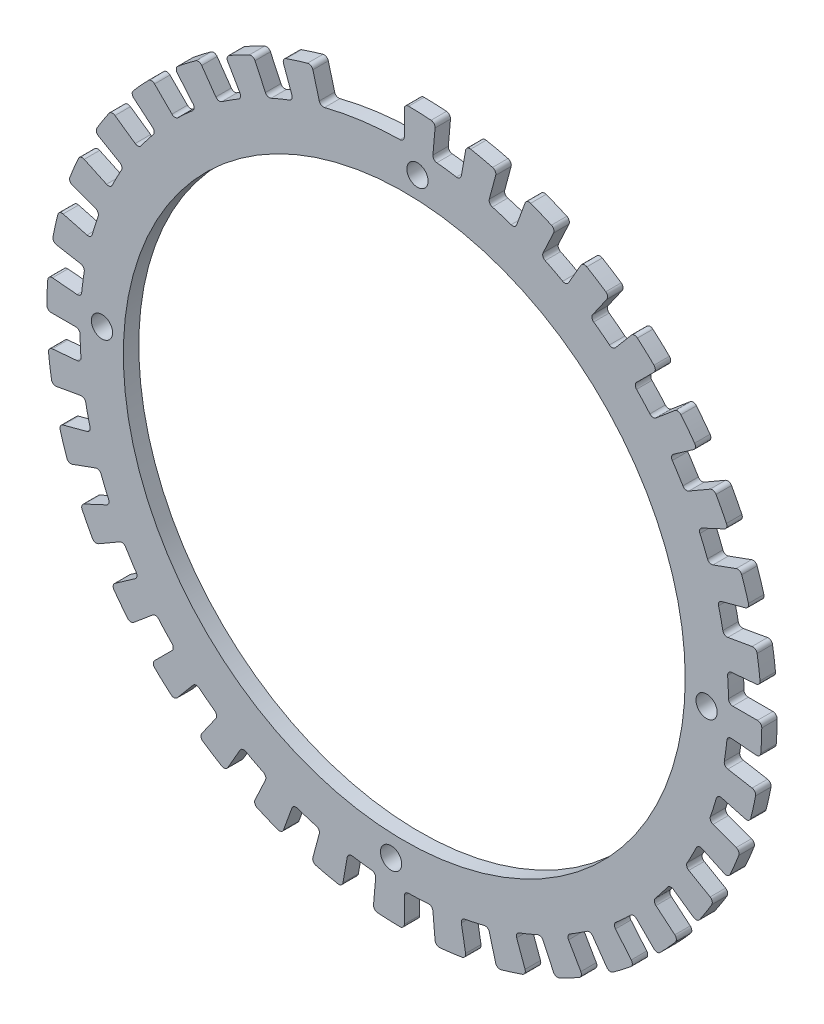
from build123d import *

# Parameters (mm, degrees)
SKETCH1_R           = 64.990473148
SKETCH1_R_2         = 2.4585
BOSS_EXTRUDE1_DEPTH = 3.571875


with BuildPart() as part:
    # Sketch1 → Boss-Extrude1 (new body)
    with BuildSketch(Plane.XY):
        with BuildLine():
            Line((7.120090774, 81.383009943), (6.623263031, 75.704242859))
            ThreePointArc((6.623263031, 75.704242859), (6.849200908, 74.979353293), (7.519201706, 74.622125443))
            ThreePointArc((7.519201706, 74.622125443), (9.789464417, 74.358364603), (12.05063613, 74.025550784))
            ThreePointArc((12.05063613, 74.025550784), (12.790264576, 74.197197423), (13.196119031, 74.83890995))
            Line((13.196119031, 74.83890995), (14.185993357, 80.45276622))
            ThreePointArc((14.185993357, 80.45276622), (14.60224868, 81.101765071), (15.35649023, 81.261726586))
            ThreePointArc((15.35649023, 81.261726586), (17.899556073, 80.739679789), (20.424982959, 80.138068801))
            ThreePointArc((20.424982959, 80.138068801), (21.040955292, 79.674338181), (21.143931966, 78.910228368))
            Line((21.143931966, 78.910228368), (19.668544597, 73.404007748))
            ThreePointArc((19.668544597, 73.404007748), (19.765174218, 72.650897183), (20.362964234, 72.182752009))
            ThreePointArc((20.362964234, 72.182752009), (22.552934963, 71.528771306), (24.721961884, 70.808365329))
            ThreePointArc((24.721961884, 70.808365329), (25.480159838, 70.848969138), (25.991280663, 71.410456724))
            Line((25.991280663, 71.410456724), (27.940952485, 76.76713603))
            ThreePointArc((27.940952485, 76.76713603), (28.463581422, 77.333993152), (29.234141374, 77.360551822))
            ThreePointArc((29.234141374, 77.360551822), (31.647919857, 76.404837339), (34.030511182, 75.373830397))
            ThreePointArc((34.030511182, 75.373830397), (34.556599534, 74.810182414), (34.525325484, 74.039799434))
            Line((34.525325484, 74.039799434), (32.116207389, 68.873429005))
            ThreePointArc((32.116207389, 68.873429005), (32.080592711, 68.114980325), (32.588008397, 67.550142181))
            ThreePointArc((32.588008397, 67.550142181), (34.631145993, 66.525812488), (36.642123336, 65.439703525))
            ThreePointArc((36.642123336, 65.439703525), (37.395853336, 65.348030778), (37.996710384, 65.812232905))
            Line((37.996710384, 65.812232905), (40.84693991, 70.748975258))
            ThreePointArc((40.84693991, 70.748975258), (41.460062645, 71.216466984), (42.223527925, 71.108815836))
            ThreePointArc((42.223527925, 71.108815836), (44.43467761, 69.748472569), (46.602039543, 68.319396297))
            ThreePointArc((46.602039543, 68.319396297), (47.022258986, 67.67295711), (46.857684459, 66.91970866))
            Line((46.857684459, 66.91970866), (43.58803547, 62.250165975))
            ThreePointArc((43.58803547, 62.250165975), (43.421258628, 61.509424257), (43.822882416, 60.865055465))
            ThreePointArc((43.822882416, 60.865055465), (45.657107176, 59.501500522), (47.448932412, 58.082689443))
            ThreePointArc((47.448932412, 58.082689443), (48.175292755, 57.86152557), (48.847629287, 58.214337693))
            Line((48.847629287, 58.214337693), (52.511813735, 62.581142673))
            ThreePointArc((52.511813735, 62.581142673), (53.196800845, 62.935064503), (53.929973946, 62.696474464))
            ThreePointArc((53.929973946, 62.696474464), (55.87131017, 60.972835754), (57.757588515, 59.189111912))
            ThreePointArc((57.757588515, 59.189111912), (58.059170893, 58.479523249), (57.766296402, 57.766296402))
            Line((57.766296402, 57.766296402), (53.735463151, 53.735463151))
            ThreePointArc((53.735463151, 53.735463151), (53.442591574, 53.034935459), (53.726220327, 52.330614838))
            ThreePointArc((53.726220327, 52.330614838), (55.295800261, 50.669265571), (56.814029687, 48.960862234))
            ThreePointArc((56.814029687, 48.960862234), (57.490950281, 48.616927187), (58.214337693, 48.847629287))
            Line((58.214337693, 48.847629287), (62.581142673, 52.511813735))
            ThreePointArc((62.581142673, 52.511813735), (63.31718117, 52.741411935), (63.997784998, 52.379132441))
            ThreePointArc((63.997784998, 52.379132441), (65.610321242, 50.344570179), (67.158202386, 48.260396313))
            ThreePointArc((67.158202386, 48.260396313), (67.331984272, 47.509218665), (66.91970866, 46.857684459))
            Line((66.91970866, 46.857684459), (62.250165975, 43.58803547))
            ThreePointArc((62.250165975, 43.58803547), (61.840098418, 42.949006984), (61.997114221, 42.20613496))
            ThreePointArc((61.997114221, 42.20613496), (63.254358436, 40.297470626), (64.45286142, 38.351384001))
            ThreePointArc((64.45286142, 38.351384001), (65.059774375, 37.895128073), (65.812232905, 37.996710384))
            Line((65.812232905, 37.996710384), (70.748975258, 40.84693991))
            ThreePointArc((70.748975258, 40.84693991), (71.513700985, 40.945238253), (72.121055738, 40.470276985))
            ThreePointArc((72.121055738, 40.470276985), (73.355795904, 38.186610315), (74.518248261, 35.865312993))
            ThreePointArc((74.518248261, 35.865312993), (74.55894938, 35.095370514), (74.039799434, 34.525325484))
            Line((74.039799434, 34.525325484), (68.873429005, 32.116207389))
            ThreePointArc((68.873429005, 32.116207389), (68.358625165, 31.558094665), (68.384257172, 30.799243028))
            ThreePointArc((68.384257172, 30.799243028), (69.290964938, 28.701257427), (70.133325573, 26.576618372))
            ThreePointArc((70.133325573, 26.576618372), (70.651790146, 26.021904668), (71.410456724, 25.991280663))
            Line((71.410456724, 25.991280663), (76.76713603, 27.940952485))
            ThreePointArc((76.76713603, 27.940952485), (77.537313183, 27.904964226), (78.052964694, 27.331752641))
            ThreePointArc((78.052964694, 27.331752641), (78.872391827, 24.868369619), (79.614094871, 22.380480286))
            ThreePointArc((79.614094871, 22.380480286), (79.52047854, 21.615167288), (78.910228368, 21.143931966))
            Line((78.910228368, 21.143931966), (73.404007748, 19.668544597))
            ThreePointArc((73.404007748, 19.668544597), (72.800109677, 19.208305609), (72.693579072, 18.456531682))
            ThreePointArc((72.693579072, 18.456531682), (73.222200534, 16.232971045), (73.682824118, 13.994335642))
            ThreePointArc((73.682824118, 13.994335642), (74.097087025, 13.358018857), (74.83890995, 13.196119031))
            Line((74.83890995, 13.196119031), (80.45276622, 14.185993357))
            ThreePointArc((80.45276622, 14.185993357), (81.204993357, 14.016811982), (81.613273815, 13.362766823))
            ThreePointArc((81.613273815, 13.362766823), (81.992490036, 10.794516097), (82.290907495, 8.215628011))
            ThreePointArc((82.290907495, 8.215628011), (82.065818199, 7.478198142), (81.383009943, 7.120090774))
            Line((81.383009943, 7.120090774), (75.704242859, 6.623263031))
            ThreePointArc((75.704242859, 6.623263031), (75.029599695, 6.274881906), (74.794143357, 5.55302796))
            ThreePointArc((74.794143357, 5.55302796), (74.928616619, 3.271454052), (74.993507337, 0.986842105))
            ThreePointArc((74.993507337, 0.986842105), (75.290981409, 0.288256403), (75.993420768, 0))
            Line((75.993420768, 0), (81.69387982, 0))
            ThreePointArc((81.69387982, 0), (82.405300898, -0.297234001), (82.693804909, -1.012239902))
            ThreePointArc((82.693804909, -1.012239902), (82.621287925, -3.607323335), (82.467352536, -6.198851964))
            ThreePointArc((82.467352536, -6.198851964), (82.1176295, -6.88599227), (81.383009943, -7.120090774))
            Line((81.383009943, -7.120090774), (75.704242859, -6.623263031))
            ThreePointArc((75.704242859, -6.623263031), (74.979353293, -6.849200908), (74.622125443, -7.519201706))
            ThreePointArc((74.622125443, -7.519201706), (74.358364603, -9.789464417), (74.025550784, -12.05063613))
            ThreePointArc((74.025550784, -12.05063613), (74.197197423, -12.790264576), (74.83890995, -13.196119031))
            Line((74.83890995, -13.196119031), (80.45276622, -14.185993357))
            ThreePointArc((80.45276622, -14.185993357), (81.101765071, -14.60224868), (81.261726586, -15.35649023))
            ThreePointArc((81.261726586, -15.35649023), (80.739679789, -17.899556073), (80.138068801, -20.424982959))
            ThreePointArc((80.138068801, -20.424982959), (79.674338181, -21.040955292), (78.910228368, -21.143931966))
            Line((78.910228368, -21.143931966), (73.404007748, -19.668544597))
            ThreePointArc((73.404007748, -19.668544597), (72.650897183, -19.765174218), (72.182752009, -20.362964234))
            ThreePointArc((72.182752009, -20.362964234), (71.528771306, -22.552934963), (70.808365329, -24.721961884))
            ThreePointArc((70.808365329, -24.721961884), (70.848969138, -25.480159838), (71.410456724, -25.991280663))
            Line((71.410456724, -25.991280663), (76.76713603, -27.940952485))
            ThreePointArc((76.76713603, -27.940952485), (77.333993152, -28.463581422), (77.360551822, -29.234141374))
            ThreePointArc((77.360551822, -29.234141374), (76.404837339, -31.647919857), (75.373830397, -34.030511182))
            ThreePointArc((75.373830397, -34.030511182), (74.810182414, -34.556599534), (74.039799434, -34.525325484))
            Line((74.039799434, -34.525325484), (68.873429005, -32.116207389))
            ThreePointArc((68.873429005, -32.116207389), (68.114980325, -32.080592711), (67.550142181, -32.588008397))
            ThreePointArc((67.550142181, -32.588008397), (66.525812488, -34.631145993), (65.439703525, -36.642123336))
            ThreePointArc((65.439703525, -36.642123336), (65.348030778, -37.395853336), (65.812232905, -37.996710384))
            Line((65.812232905, -37.996710384), (70.748975258, -40.84693991))
            ThreePointArc((70.748975258, -40.84693991), (71.216466984, -41.460062645), (71.108815836, -42.223527925))
            ThreePointArc((71.108815836, -42.223527925), (69.748472569, -44.43467761), (68.319396297, -46.602039543))
            ThreePointArc((68.319396297, -46.602039543), (67.67295711, -47.022258986), (66.91970866, -46.857684459))
            Line((66.91970866, -46.857684459), (62.250165974, -43.58803547))
            ThreePointArc((62.250165974, -43.58803547), (61.509424257, -43.421258628), (60.865055465, -43.822882416))
            ThreePointArc((60.865055465, -43.822882416), (59.501500522, -45.657107176), (58.082689443, -47.448932412))
            ThreePointArc((58.082689443, -47.448932412), (57.86152557, -48.175292755), (58.214337693, -48.847629287))
            Line((58.214337693, -48.847629287), (62.581142673, -52.511813735))
            ThreePointArc((62.581142673, -52.511813735), (62.935064503, -53.196800845), (62.696474464, -53.929973946))
            ThreePointArc((62.696474464, -53.929973946), (60.972835754, -55.87131017), (59.189111912, -57.757588515))
            ThreePointArc((59.189111912, -57.757588515), (58.479523249, -58.059170893), (57.766296402, -57.766296402))
            Line((57.766296402, -57.766296402), (53.735463151, -53.735463151))
            ThreePointArc((53.735463151, -53.735463151), (53.034935459, -53.442591574), (52.330614838, -53.726220327))
            ThreePointArc((52.330614838, -53.726220327), (50.669265571, -55.295800261), (48.960862234, -56.814029687))
            ThreePointArc((48.960862234, -56.814029687), (48.616927187, -57.490950281), (48.847629287, -58.214337693))
            Line((48.847629287, -58.214337693), (52.511813735, -62.581142673))
            ThreePointArc((52.511813735, -62.581142673), (52.741411935, -63.31718117), (52.379132441, -63.997784998))
            ThreePointArc((52.379132441, -63.997784998), (50.344570179, -65.610321242), (48.260396313, -67.158202386))
            ThreePointArc((48.260396313, -67.158202386), (47.509218665, -67.331984272), (46.857684459, -66.91970866))
            Line((46.857684459, -66.91970866), (43.58803547, -62.250165975))
            ThreePointArc((43.58803547, -62.250165975), (42.949006984, -61.840098418), (42.20613496, -61.997114221))
            ThreePointArc((42.20613496, -61.997114221), (40.297470626, -63.254358436), (38.351384001, -64.45286142))
            ThreePointArc((38.351384001, -64.45286142), (37.895128073, -65.059774375), (37.996710384, -65.812232905))
            Line((37.996710384, -65.812232905), (40.84693991, -70.748975258))
            ThreePointArc((40.84693991, -70.748975258), (40.945238253, -71.513700985), (40.470276985, -72.121055738))
            ThreePointArc((40.470276985, -72.121055738), (38.186610315, -73.355795904), (35.865312993, -74.518248261))
            ThreePointArc((35.865312993, -74.518248261), (35.095370514, -74.55894938), (34.525325484, -74.039799434))
            Line((34.525325484, -74.039799434), (32.116207389, -68.873429005))
            ThreePointArc((32.116207389, -68.873429005), (31.558094665, -68.358625165), (30.799243028, -68.384257172))
            ThreePointArc((30.799243028, -68.384257172), (28.701257427, -69.290964938), (26.576618372, -70.133325573))
            ThreePointArc((26.576618372, -70.133325573), (26.021904668, -70.651790146), (25.991280663, -71.410456724))
            Line((25.991280663, -71.410456724), (27.940952485, -76.76713603))
            ThreePointArc((27.940952485, -76.76713603), (27.904964226, -77.537313183), (27.331752641, -78.052964694))
            ThreePointArc((27.331752641, -78.052964694), (24.868369619, -78.872391827), (22.380480286, -79.614094871))
            ThreePointArc((22.380480286, -79.614094871), (21.615167288, -79.52047854), (21.143931966, -78.910228368))
            Line((21.143931966, -78.910228368), (19.668544597, -73.404007748))
            ThreePointArc((19.668544597, -73.404007748), (19.208305609, -72.800109677), (18.456531682, -72.693579072))
            ThreePointArc((18.456531682, -72.693579072), (16.232971045, -73.222200534), (13.994335642, -73.682824118))
            ThreePointArc((13.994335642, -73.682824118), (13.358018857, -74.097087025), (13.196119031, -74.83890995))
            Line((13.196119031, -74.83890995), (14.185993357, -80.45276622))
            ThreePointArc((14.185993357, -80.45276622), (14.016811982, -81.204993357), (13.362766823, -81.613273815))
            ThreePointArc((13.362766823, -81.613273815), (10.794516097, -81.992490036), (8.215628011, -82.290907495))
            ThreePointArc((8.215628011, -82.290907495), (7.478198142, -82.065818199), (7.120090774, -81.383009943))
            Line((7.120090774, -81.383009943), (6.623263031, -75.704242859))
            ThreePointArc((6.623263031, -75.704242859), (6.274881906, -75.029599695), (5.55302796, -74.794143357))
            ThreePointArc((5.55302796, -74.794143357), (3.271454052, -74.928616619), (0.986842105, -74.993507337))
            ThreePointArc((0.986842105, -74.993507337), (0.288256403, -75.290981409), (0, -75.993420768))
            Line((0, -75.993420768), (0, -81.69387982))
            ThreePointArc((0, -81.69387982), (-0.297234001, -82.405300898), (-1.012239902, -82.693804909))
            ThreePointArc((-1.012239902, -82.693804909), (-3.607323335, -82.621287925), (-6.198851964, -82.467352536))
            ThreePointArc((-6.198851964, -82.467352536), (-6.88599227, -82.1176295), (-7.120090774, -81.383009943))
            Line((-7.120090774, -81.383009943), (-6.623263031, -75.704242859))
            ThreePointArc((-6.623263031, -75.704242859), (-6.849200908, -74.979353293), (-7.519201706, -74.622125443))
            ThreePointArc((-7.519201706, -74.622125443), (-9.789464417, -74.358364603), (-12.05063613, -74.025550784))
            ThreePointArc((-12.05063613, -74.025550784), (-12.790264576, -74.197197423), (-13.196119031, -74.83890995))
            Line((-13.196119031, -74.83890995), (-14.185993357, -80.45276622))
            ThreePointArc((-14.185993357, -80.45276622), (-14.60224868, -81.101765071), (-15.35649023, -81.261726586))
            ThreePointArc((-15.35649023, -81.261726586), (-17.899556073, -80.739679789), (-20.424982959, -80.138068801))
            ThreePointArc((-20.424982959, -80.138068801), (-21.040955292, -79.674338181), (-21.143931966, -78.910228368))
            Line((-21.143931966, -78.910228368), (-19.668544597, -73.404007748))
            ThreePointArc((-19.668544597, -73.404007748), (-19.765174218, -72.650897183), (-20.362964234, -72.182752009))
            ThreePointArc((-20.362964234, -72.182752009), (-22.552934963, -71.528771306), (-24.721961884, -70.808365329))
            ThreePointArc((-24.721961884, -70.808365329), (-25.480159838, -70.848969138), (-25.991280663, -71.410456724))
            Line((-25.991280663, -71.410456724), (-27.940952485, -76.76713603))
            ThreePointArc((-27.940952485, -76.76713603), (-28.463581422, -77.333993152), (-29.234141374, -77.360551822))
            ThreePointArc((-29.234141374, -77.360551822), (-31.647919857, -76.404837339), (-34.030511182, -75.373830397))
            ThreePointArc((-34.030511182, -75.373830397), (-34.556599534, -74.810182414), (-34.525325484, -74.039799434))
            Line((-34.525325484, -74.039799434), (-32.116207389, -68.873429005))
            ThreePointArc((-32.116207389, -68.873429005), (-32.080592711, -68.114980325), (-32.588008397, -67.550142181))
            ThreePointArc((-32.588008397, -67.550142181), (-34.631145993, -66.525812488), (-36.642123336, -65.439703525))
            ThreePointArc((-36.642123336, -65.439703525), (-37.395853336, -65.348030778), (-37.996710384, -65.812232905))
            Line((-37.996710384, -65.812232905), (-40.84693991, -70.748975258))
            ThreePointArc((-40.84693991, -70.748975258), (-41.460062645, -71.216466984), (-42.223527925, -71.108815836))
            ThreePointArc((-42.223527925, -71.108815836), (-44.43467761, -69.748472569), (-46.602039543, -68.319396297))
            ThreePointArc((-46.602039543, -68.319396297), (-47.022258986, -67.67295711), (-46.857684459, -66.91970866))
            Line((-46.857684459, -66.91970866), (-43.58803547, -62.250165974))
            ThreePointArc((-43.58803547, -62.250165974), (-43.421258628, -61.509424257), (-43.822882416, -60.865055465))
            ThreePointArc((-43.822882416, -60.865055465), (-45.657107176, -59.501500522), (-47.448932412, -58.082689443))
            ThreePointArc((-47.448932412, -58.082689443), (-48.175292755, -57.86152557), (-48.847629287, -58.214337693))
            Line((-48.847629287, -58.214337693), (-52.511813735, -62.581142673))
            ThreePointArc((-52.511813735, -62.581142673), (-53.196800845, -62.935064503), (-53.929973946, -62.696474464))
            ThreePointArc((-53.929973946, -62.696474464), (-55.87131017, -60.972835754), (-57.757588515, -59.189111912))
            ThreePointArc((-57.757588515, -59.189111912), (-58.059170893, -58.479523249), (-57.766296402, -57.766296402))
            Line((-57.766296402, -57.766296402), (-53.735463151, -53.735463151))
            ThreePointArc((-53.735463151, -53.735463151), (-53.442591574, -53.034935459), (-53.726220327, -52.330614838))
            ThreePointArc((-53.726220327, -52.330614838), (-55.295800261, -50.669265571), (-56.814029687, -48.960862234))
            ThreePointArc((-56.814029687, -48.960862234), (-57.490950281, -48.616927187), (-58.214337693, -48.847629287))
            Line((-58.214337693, -48.847629287), (-62.581142673, -52.511813735))
            ThreePointArc((-62.581142673, -52.511813735), (-63.31718117, -52.741411935), (-63.997784998, -52.379132441))
            ThreePointArc((-63.997784998, -52.379132441), (-65.610321242, -50.344570179), (-67.158202386, -48.260396313))
            ThreePointArc((-67.158202386, -48.260396313), (-67.331984272, -47.509218665), (-66.91970866, -46.857684459))
            Line((-66.91970866, -46.857684459), (-62.250165975, -43.58803547))
            ThreePointArc((-62.250165975, -43.58803547), (-61.840098418, -42.949006984), (-61.997114221, -42.20613496))
            ThreePointArc((-61.997114221, -42.20613496), (-63.254358436, -40.297470626), (-64.45286142, -38.351384001))
            ThreePointArc((-64.45286142, -38.351384001), (-65.059774375, -37.895128073), (-65.812232905, -37.996710384))
            Line((-65.812232905, -37.996710384), (-70.748975258, -40.84693991))
            ThreePointArc((-70.748975258, -40.84693991), (-71.513700985, -40.945238253), (-72.121055738, -40.470276985))
            ThreePointArc((-72.121055738, -40.470276985), (-73.355795904, -38.186610315), (-74.518248261, -35.865312993))
            ThreePointArc((-74.518248261, -35.865312993), (-74.55894938, -35.095370514), (-74.039799434, -34.525325484))
            Line((-74.039799434, -34.525325484), (-68.873429005, -32.116207389))
            ThreePointArc((-68.873429005, -32.116207389), (-68.358625165, -31.558094665), (-68.384257172, -30.799243028))
            ThreePointArc((-68.384257172, -30.799243028), (-69.290964938, -28.701257427), (-70.133325573, -26.576618372))
            ThreePointArc((-70.133325573, -26.576618372), (-70.651790146, -26.021904668), (-71.410456724, -25.991280663))
            Line((-71.410456724, -25.991280663), (-76.76713603, -27.940952485))
            ThreePointArc((-76.76713603, -27.940952485), (-77.537313183, -27.904964226), (-78.052964694, -27.331752641))
            ThreePointArc((-78.052964694, -27.331752641), (-78.872391827, -24.868369619), (-79.614094871, -22.380480286))
            ThreePointArc((-79.614094871, -22.380480286), (-79.52047854, -21.615167288), (-78.910228368, -21.143931966))
            Line((-78.910228368, -21.143931966), (-73.404007748, -19.668544597))
            ThreePointArc((-73.404007748, -19.668544597), (-72.800109677, -19.208305609), (-72.693579072, -18.456531682))
            ThreePointArc((-72.693579072, -18.456531682), (-73.222200534, -16.232971045), (-73.682824118, -13.994335642))
            ThreePointArc((-73.682824118, -13.994335642), (-74.097087025, -13.358018857), (-74.83890995, -13.196119031))
            Line((-74.83890995, -13.196119031), (-80.45276622, -14.185993357))
            ThreePointArc((-80.45276622, -14.185993357), (-81.204993357, -14.016811982), (-81.613273815, -13.362766823))
            ThreePointArc((-81.613273815, -13.362766823), (-81.992490036, -10.794516097), (-82.290907495, -8.215628011))
            ThreePointArc((-82.290907495, -8.215628011), (-82.065818199, -7.478198142), (-81.383009943, -7.120090774))
            Line((-81.383009943, -7.120090774), (-75.704242859, -6.623263031))
            ThreePointArc((-75.704242859, -6.623263031), (-75.029599695, -6.274881906), (-74.794143357, -5.55302796))
            ThreePointArc((-74.794143357, -5.55302796), (-74.928616619, -3.271454052), (-74.993507337, -0.986842105))
            ThreePointArc((-74.993507337, -0.986842105), (-75.290981409, -0.288256403), (-75.993420768, 0))
            Line((-75.993420768, 0), (-81.69387982, 0))
            ThreePointArc((-81.69387982, 0), (-82.405300898, 0.297234001), (-82.693804909, 1.012239902))
            ThreePointArc((-82.693804909, 1.012239902), (-82.621287925, 3.607323335), (-82.467352536, 6.198851964))
            ThreePointArc((-82.467352536, 6.198851964), (-82.1176295, 6.88599227), (-81.383009943, 7.120090774))
            Line((-81.383009943, 7.120090774), (-75.704242859, 6.623263031))
            ThreePointArc((-75.704242859, 6.623263031), (-74.979353293, 6.849200908), (-74.622125443, 7.519201706))
            ThreePointArc((-74.622125443, 7.519201706), (-74.358364603, 9.789464417), (-74.025550784, 12.05063613))
            ThreePointArc((-74.025550784, 12.05063613), (-74.197197423, 12.790264576), (-74.83890995, 13.196119031))
            Line((-74.83890995, 13.196119031), (-80.45276622, 14.185993357))
            ThreePointArc((-80.45276622, 14.185993357), (-81.101765071, 14.60224868), (-81.261726586, 15.35649023))
            ThreePointArc((-81.261726586, 15.35649023), (-80.739679789, 17.899556073), (-80.138068801, 20.424982959))
            ThreePointArc((-80.138068801, 20.424982959), (-79.674338181, 21.040955292), (-78.910228368, 21.143931966))
            Line((-78.910228368, 21.143931966), (-73.404007748, 19.668544597))
            ThreePointArc((-73.404007748, 19.668544597), (-72.650897183, 19.765174218), (-72.182752009, 20.362964234))
            ThreePointArc((-72.182752009, 20.362964234), (-71.528771306, 22.552934963), (-70.808365329, 24.721961884))
            ThreePointArc((-70.808365329, 24.721961884), (-70.848969138, 25.480159838), (-71.410456724, 25.991280663))
            Line((-71.410456724, 25.991280663), (-76.76713603, 27.940952485))
            ThreePointArc((-76.76713603, 27.940952485), (-77.333993152, 28.463581422), (-77.360551822, 29.234141374))
            ThreePointArc((-77.360551822, 29.234141374), (-76.404837339, 31.647919857), (-75.373830397, 34.030511182))
            ThreePointArc((-75.373830397, 34.030511182), (-74.810182414, 34.556599534), (-74.039799434, 34.525325484))
            Line((-74.039799434, 34.525325484), (-68.873429005, 32.116207389))
            ThreePointArc((-68.873429005, 32.116207389), (-68.114980325, 32.080592711), (-67.550142181, 32.588008397))
            ThreePointArc((-67.550142181, 32.588008397), (-66.525812488, 34.631145993), (-65.439703525, 36.642123336))
            ThreePointArc((-65.439703525, 36.642123336), (-65.348030778, 37.395853336), (-65.812232905, 37.996710384))
            Line((-65.812232905, 37.996710384), (-70.748975258, 40.84693991))
            ThreePointArc((-70.748975258, 40.84693991), (-71.216466984, 41.460062645), (-71.108815836, 42.223527925))
            ThreePointArc((-71.108815836, 42.223527925), (-69.748472569, 44.43467761), (-68.319396297, 46.602039543))
            ThreePointArc((-68.319396297, 46.602039543), (-67.67295711, 47.022258986), (-66.91970866, 46.857684459))
            Line((-66.91970866, 46.857684459), (-62.250165974, 43.58803547))
            ThreePointArc((-62.250165974, 43.58803547), (-61.509424257, 43.421258628), (-60.865055465, 43.822882416))
            ThreePointArc((-60.865055465, 43.822882416), (-59.501500522, 45.657107176), (-58.082689443, 47.448932412))
            ThreePointArc((-58.082689443, 47.448932412), (-57.86152557, 48.175292755), (-58.214337693, 48.847629287))
            Line((-58.214337693, 48.847629287), (-62.581142673, 52.511813735))
            ThreePointArc((-62.581142673, 52.511813735), (-62.935064503, 53.196800845), (-62.696474464, 53.929973946))
            ThreePointArc((-62.696474464, 53.929973946), (-60.972835754, 55.87131017), (-59.189111912, 57.757588515))
            ThreePointArc((-59.189111912, 57.757588515), (-58.479523249, 58.059170893), (-57.766296402, 57.766296402))
            Line((-57.766296402, 57.766296402), (-53.735463151, 53.735463151))
            ThreePointArc((-53.735463151, 53.735463151), (-53.034935459, 53.442591574), (-52.330614838, 53.726220327))
            ThreePointArc((-52.330614838, 53.726220327), (-50.669265571, 55.295800261), (-48.960862234, 56.814029687))
            ThreePointArc((-48.960862234, 56.814029687), (-48.616927187, 57.490950281), (-48.847629287, 58.214337693))
            Line((-48.847629287, 58.214337693), (-52.511813735, 62.581142673))
            ThreePointArc((-52.511813735, 62.581142673), (-52.741411935, 63.31718117), (-52.379132441, 63.997784998))
            ThreePointArc((-52.379132441, 63.997784998), (-50.344570179, 65.610321242), (-48.260396313, 67.158202386))
            ThreePointArc((-48.260396313, 67.158202386), (-47.509218665, 67.331984272), (-46.857684459, 66.91970866))
            Line((-46.857684459, 66.91970866), (-43.58803547, 62.250165975))
            ThreePointArc((-43.58803547, 62.250165975), (-42.949006984, 61.840098418), (-42.20613496, 61.997114221))
            ThreePointArc((-42.20613496, 61.997114221), (-40.297470626, 63.254358436), (-38.351384001, 64.45286142))
            ThreePointArc((-38.351384001, 64.45286142), (-37.895128073, 65.059774375), (-37.996710384, 65.812232905))
            Line((-37.996710384, 65.812232905), (-40.84693991, 70.748975258))
            ThreePointArc((-40.84693991, 70.748975258), (-40.945238253, 71.513700985), (-40.470276985, 72.121055738))
            ThreePointArc((-40.470276985, 72.121055738), (-38.186610315, 73.355795904), (-35.865312993, 74.518248261))
            ThreePointArc((-35.865312993, 74.518248261), (-35.095370514, 74.55894938), (-34.525325484, 74.039799434))
            Line((-34.525325484, 74.039799434), (-32.116207389, 68.873429005))
            ThreePointArc((-32.116207389, 68.873429005), (-31.558094665, 68.358625165), (-30.799243028, 68.384257172))
            ThreePointArc((-30.799243028, 68.384257172), (-28.701257427, 69.290964938), (-26.576618372, 70.133325573))
            ThreePointArc((-26.576618372, 70.133325573), (-26.021904668, 70.651790146), (-25.991280663, 71.410456724))
            Line((-25.991280663, 71.410456724), (-27.940952485, 76.76713603))
            ThreePointArc((-27.940952485, 76.76713603), (-27.904964226, 77.537313183), (-27.331752641, 78.052964694))
            ThreePointArc((-27.331752641, 78.052964694), (-24.868369619, 78.872391827), (-22.380480286, 79.614094871))
            ThreePointArc((-22.380480286, 79.614094871), (-21.615167288, 79.52047854), (-21.143931966, 78.910228368))
            Line((-21.143931966, 78.910228368), (-19.668544597, 73.404007748))
            ThreePointArc((-19.668544597, 73.404007748), (-19.208305609, 72.800109677), (-18.456531682, 72.693579072))
            ThreePointArc((-18.456531682, 72.693579072), (-16.232971045, 73.222200534), (-13.994335642, 73.682824118))
            ThreePointArc((-13.994335642, 73.682824118), (-7.519201706, 74.622125443), (-0.986842105, 74.993507337))
            ThreePointArc((-0.986842105, 74.993507337), (-0.288256403, 75.290981409), (0, 75.993420768))
            Line((0, 75.993420768), (0, 81.69387982))
            ThreePointArc((0, 81.69387982), (0.297234001, 82.405300898), (1.012239902, 82.693804909))
            ThreePointArc((1.012239902, 82.693804909), (3.607323335, 82.621287925), (6.198851964, 82.467352536))
            ThreePointArc((6.198851964, 82.467352536), (6.88599227, 82.1176295), (7.120090774, 81.383009943))
        make_face()
        Circle(SKETCH1_R, mode=Mode.SUBTRACT)
        with Locations((3.053149338, 69.928616619)):
            Circle(SKETCH1_R_2, mode=Mode.SUBTRACT)
        with Locations((69.928616619, -3.053149338)):
            Circle(SKETCH1_R_2, mode=Mode.SUBTRACT)
        with Locations((-3.053149338, -69.928616619)):
            Circle(SKETCH1_R_2, mode=Mode.SUBTRACT)
        with Locations((-69.928616619, 3.053149338)):
            Circle(SKETCH1_R_2, mode=Mode.SUBTRACT)
    extrude(amount=BOSS_EXTRUDE1_DEPTH)


solid = part.part
